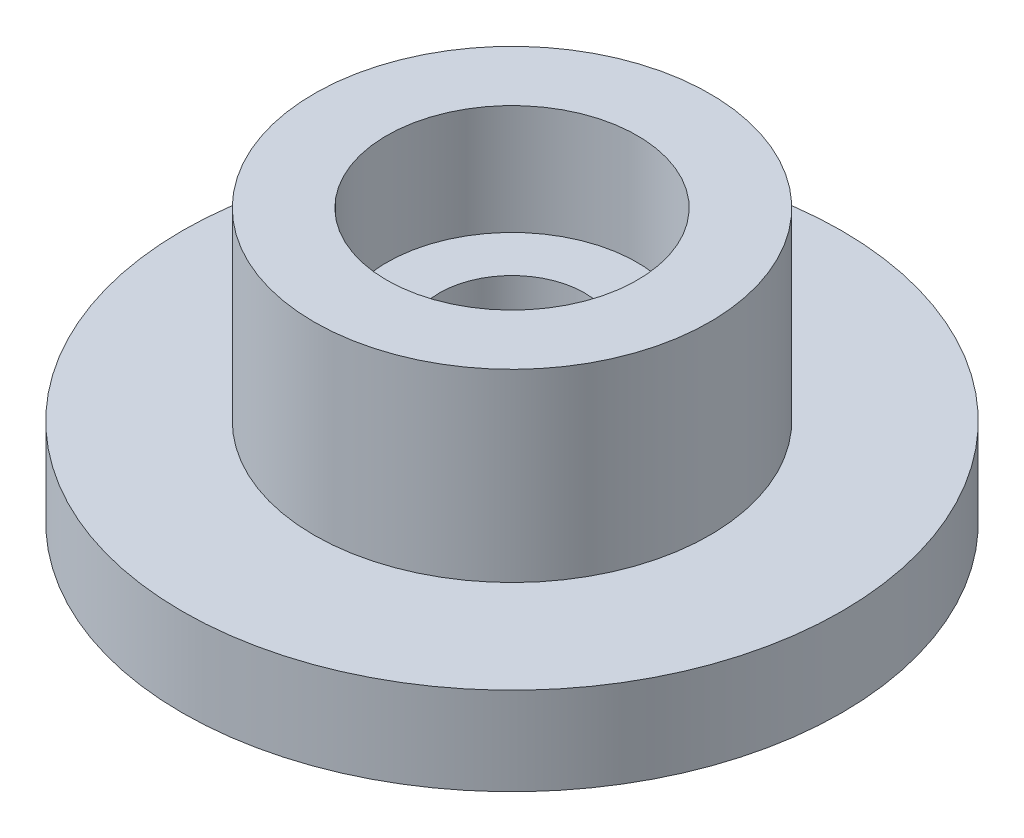
from build123d import *

# Parameters (mm, degrees)
SKETCH_1_R          = 7.5
EXTRUDE_1_DEPTH     = 2
SKETCH_4_R          = 4.5
SKETCH_4_R_2        = 2.85
EXTRUDE_2_DEPTH     = 4.2
SKETCH_5_R          = 2.85
EXTRUDE_3_DEPTH     = 1.7
SKETCH_6_R          = 1.65
CUT_EXTRUDE_1_DEPTH = 13.28576412


with BuildPart() as part:
    # 草图1 → 凸台-拉伸1 (new body)
    with BuildSketch(Plane(origin=(0, 0, 0), x_dir=(1, 0, 0), z_dir=(0, 1, 0))):
        with Locations(Location((0, 0, 0), (0, 0, 270))):
            Circle(SKETCH_1_R)
    extrude(amount=EXTRUDE_1_DEPTH)

    # 草图4 → 凸台-拉伸2 (add)
    with BuildSketch(Plane(origin=(0, 2, 0), x_dir=(1, 0, 0), z_dir=(0, 1, 0))):
        with Locations(Location((0, 0, 0), (0, 0, 270))):
            Circle(SKETCH_4_R)
        with Locations(Location((0, 0, 0), (0, 0, 270))):
            Circle(SKETCH_4_R_2, mode=Mode.SUBTRACT)
    extrude(amount=EXTRUDE_2_DEPTH)

    # 草图5 → 凸台-拉伸3 (add)
    with BuildSketch(Plane(origin=(0, 2, 0), x_dir=(1, 0, 0), z_dir=(0, 1, 0))):
        with Locations(Location((0, 0, 0), (0, 0, 270))):
            Circle(SKETCH_5_R)
    extrude(amount=EXTRUDE_3_DEPTH)

    # 草图6 → 切除-拉伸1 (cut, through all)
    with BuildSketch(Plane.XZ):
        with Locations(Location((0, 0, 0), (0, 0, 270))):
            Circle(SKETCH_6_R)
    extrude(amount=-CUT_EXTRUDE_1_DEPTH, mode=Mode.SUBTRACT)


solid = part.part
